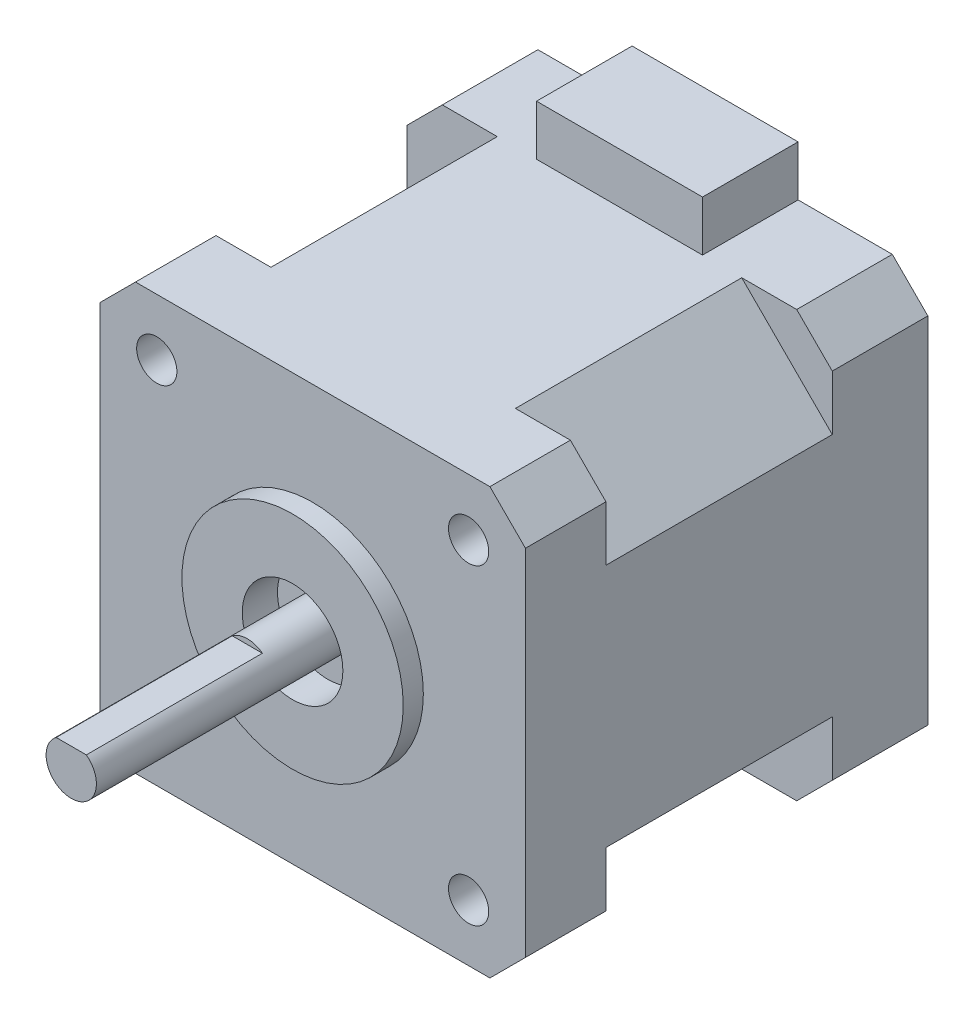
from build123d import *

# Parameters (mm, degrees)
SALIENTE_EXTRUIR1_DEPTH = 40
CROQUIS2_R              = 11
SALIENTE_EXTRUIR2_DEPTH = 2
CROQUIS3_R              = 5
CORTAR_EXTRUIR1_DEPTH   = 3.5
CROQUIS4_R              = 2.5
SALIENTE_EXTRUIR3_DEPTH = 25.5
CROQUIS5_R              = 2
CORTAR_EXTRUIR2_DEPTH   = 4.5
CORTAR_EXTRUIR3_START   = -17.5
CORTAR_EXTRUIR3_DEPTH   = 17.5
CORTAR_EXTRUIR4_START   = -8
CORTAR_EXTRUIR4_DEPTH   = 22.5
CROQUIS8_W              = 16.5
CROQUIS8_H              = 9.5
SALIENTE_EXTRUIR4_DEPTH = 5


with BuildPart() as part:
    # Croquis1 → Saliente-Extruir1 (new body)
    with BuildSketch(Plane.XY):
        Polygon((-17.614466094, -21.15), (17.614466094, -21.15), (21.15, -17.614466094), (21.15, 17.614466094), (17.614466094, 21.15), (-17.614466094, 21.15), (-21.15, 17.614466094), (-21.15, -17.614466094), align=None)
    extrude(amount=-SALIENTE_EXTRUIR1_DEPTH)

    # Croquis2 → Saliente-Extruir2 (add)
    with BuildSketch(Plane.XY):
        Circle(CROQUIS2_R)
    extrude(amount=SALIENTE_EXTRUIR2_DEPTH)

    # Croquis3 → Cortar-Extruir1 (cut)
    with BuildSketch(Plane.XY.offset(2)):
        Circle(CROQUIS3_R)
    extrude(amount=-CORTAR_EXTRUIR1_DEPTH, mode=Mode.SUBTRACT)

    # Croquis4 → Saliente-Extruir3 (add)
    with BuildSketch(Plane.XY.offset(-1.5)):
        Circle(CROQUIS4_R)
    extrude(amount=SALIENTE_EXTRUIR3_DEPTH)

    # Croquis5 → Cortar-Extruir2 (cut)
    with BuildSketch(Plane.XY):
        with Locations((-15.5, 15.5)):
            Circle(CROQUIS5_R)
        with Locations((15.5, 15.5)):
            Circle(CROQUIS5_R)
        with Locations((15.5, -15.5)):
            Circle(CROQUIS5_R)
        with Locations((-15.5, -15.5)):
            Circle(CROQUIS5_R)
    extrude(amount=-CORTAR_EXTRUIR2_DEPTH, mode=Mode.SUBTRACT)

    # Croquis6 → Cortar-Extruir3 (cut)
    with BuildSketch(Plane.XY.offset(24).offset(CORTAR_EXTRUIR3_START)):
        with BuildLine():
            Line((-1.5, 2), (1.5, 2))
            ThreePointArc((1.5, 2), (0, 2.5), (-1.5, 2))
        make_face()
    extrude(amount=CORTAR_EXTRUIR3_DEPTH, mode=Mode.SUBTRACT)

    # Croquis7 → Cortar-Extruir4 (cut)
    with BuildSketch(Plane.XY.offset(CORTAR_EXTRUIR4_START)):
        Polygon((-21.15, 12.15), (-12.15, 21.15), (-21.15, 21.15), align=None)
        Polygon((21.15, 21.15), (21.15, 12.15), (12.15, 21.15), align=None)
        Polygon((21.15, -21.15), (21.15, -12.15), (12.15, -21.15), align=None)
        Polygon((-21.15, -12.15), (-12.15, -21.15), (-21.15, -21.15), align=None)
    extrude(amount=-CORTAR_EXTRUIR4_DEPTH, mode=Mode.SUBTRACT)

    # Croquis8 → Saliente-Extruir4 (add)
    with BuildSketch(Plane(origin=(0, 21.15, 0), x_dir=(1, 0, 0), z_dir=(0, 1, 0))):
        with Locations((0, 35.25)):
            Rectangle(CROQUIS8_W, CROQUIS8_H)
    extrude(amount=SALIENTE_EXTRUIR4_DEPTH)


solid = part.part
